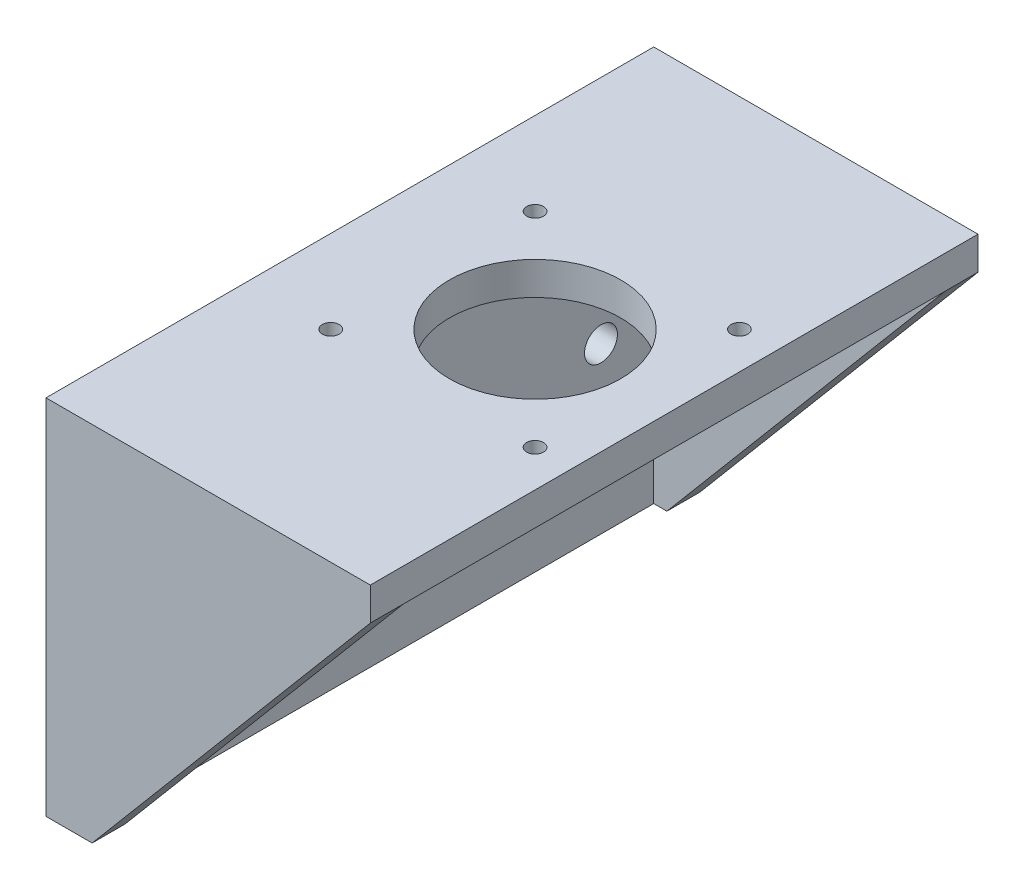
from build123d import *

# Parameters (mm, degrees)
SKETCH1_W           = 49.2
SKETCH1_H           = 92.2
SKETCH1_R           = 1.275
SKETCH1_R_2         = 13
BOSS_EXTRUDE3_DEPTH = 5
BOSS_EXTRUDE4_DEPTH = 50
CUT_EXTRUDE1_DEPTH  = 109.583838576
SKETCH3_R           = 2.5
CUT_EXTRUDE2_DEPTH  = 81.037803568
SKETCH5_W           = 82.2
SKETCH5_H           = 50
SKETCH5_R           = 2.5
CUT_EXTRUDE3_DEPTH  = 2


with BuildPart() as part:
    # Sketch1 → Boss-Extrude3 (new body)
    with BuildSketch(Plane(origin=(0, 0, 0), x_dir=(1, 0, 0), z_dir=(0, 1, 0))):
        with Locations((-3.5, 0)):
            Rectangle(SKETCH1_W, SKETCH1_H)
        with Locations((-15.5, -15.5)):
            Circle(SKETCH1_R, mode=Mode.SUBTRACT)
        with Locations((15.5, -15.5)):
            Circle(SKETCH1_R, mode=Mode.SUBTRACT)
        with Locations((-15.5, 15.5)):
            Circle(SKETCH1_R, mode=Mode.SUBTRACT)
        Circle(SKETCH1_R_2, mode=Mode.SUBTRACT)
        with Locations((15.5, 15.5)):
            Circle(SKETCH1_R, mode=Mode.SUBTRACT)
    extrude(amount=BOSS_EXTRUDE3_DEPTH)

    # Sketch1<3> → Boss-Extrude4 (add)
    with BuildSketch(Plane(origin=(0, 0, 0), x_dir=(1, 0, 0), z_dir=(0, 1, 0))):
        Polygon((-21.1, 41.1), (21.1, 41.1), (21.1, 46.1), (-28.1, 46.1), (-28.1, -46.1), (21.1, -46.1), (21.1, -41.1), (-21.1, -41.1), align=None)
    extrude(amount=-BOSS_EXTRUDE4_DEPTH)

    # Sketch2 → Cut-Extrude1 (cut, through all)
    with BuildSketch(Plane.XY.offset(46.1)):
        Polygon((21.1, 0), (-21.1, -50), (21.1, -50), align=None)
    extrude(amount=-CUT_EXTRUDE1_DEPTH, mode=Mode.SUBTRACT)

    # Sketch3 → Cut-Extrude2 (cut, through all)
    with BuildSketch(Plane(origin=(-21.1, 0, 0), x_dir=(0, 0, -1), z_dir=(1, 0, 0))):
        with Locations((-33.1, -25)):
            Circle(SKETCH3_R)
        with Locations((33.1, -25)):
            Circle(SKETCH3_R)
    extrude(amount=-CUT_EXTRUDE2_DEPTH, mode=Mode.SUBTRACT)

    # Sketch5 → Cut-Extrude3 (cut)
    with BuildSketch(Plane(origin=(-21.1, 0, 0), x_dir=(0, 0, -1), z_dir=(1, 0, 0))):
        with Locations((0, -25)):
            Rectangle(SKETCH5_W, SKETCH5_H)
        with Locations((33.1, -25)):
            Circle(SKETCH5_R, mode=Mode.SUBTRACT)
        with Locations((-33.1, -25)):
            Circle(SKETCH5_R, mode=Mode.SUBTRACT)
    extrude(amount=-CUT_EXTRUDE3_DEPTH, mode=Mode.SUBTRACT)


solid = part.part
